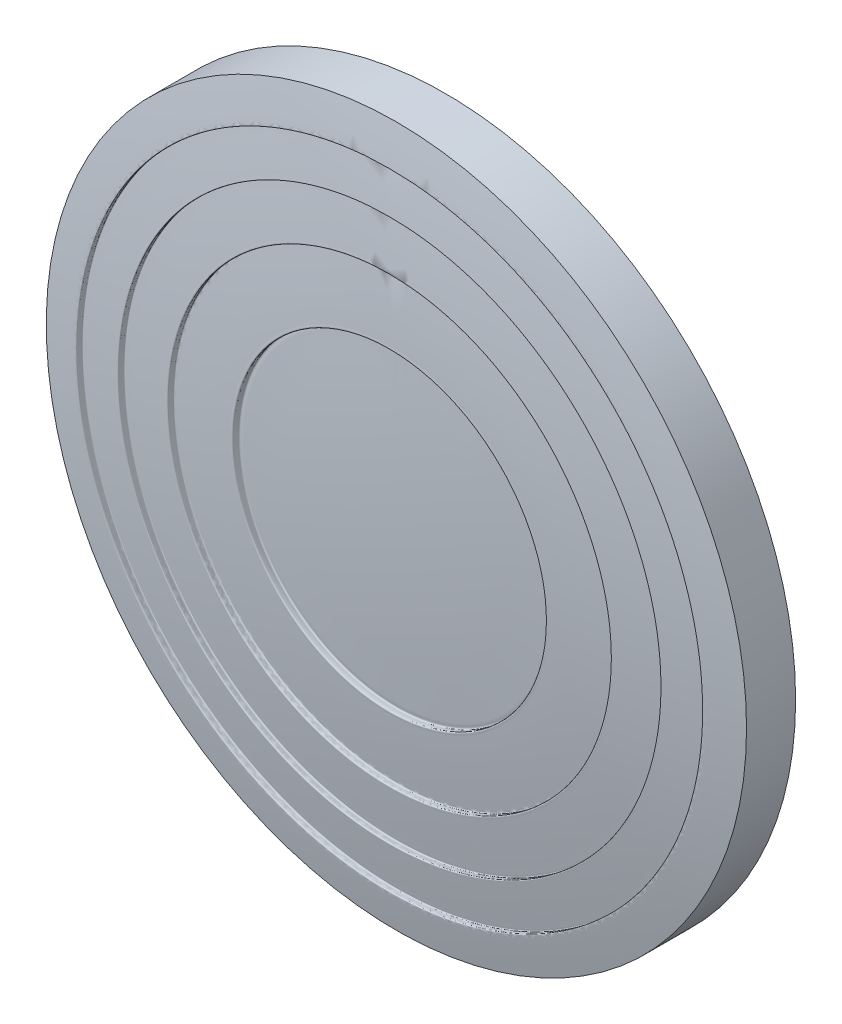
from build123d import *


with BuildPart() as part:
    # 草图3 → 旋转1 (revolve)
    with BuildSketch(Plane(origin=(0, 0, 0), x_dir=(0, 0, -1), z_dir=(1, 0, 0)), mode=Mode.PRIVATE) as revolve_1_sk:
        with BuildLine():
            Line((0, 5), (0.701015432, 5))
            Line((0.701015432, 5), (0.701015432, 0))
            Line((0.701015432, 0), (-0.10102051, 0))
            add(Edge.make_bspline(
                [(-0.10102051, 0), (-0.101012409, 0.015293919), (-0.100996206, 0.045881757), (-0.100646654, 0.168232704), (-0.098279915, 0.428222335), (-0.086950462, 0.90221887), (-0.064778455, 1.375856153), (-0.041552217, 1.726854364), (-0.03145601, 1.864129781), (-0.026803448, 1.925126023), (-0.02322188, 1.970874213), (-0.019586973, 2.016587805), (-0.015753867, 2.06239895), (-0.012263319, 2.107813726), (-0.007097278, 2.154674747), (-0.007787186, 2.196104551), (0.022411944, 2.282471532), (-0.111091677, 2.211001779), (-0.098584823, 2.26478721), (-0.097770103, 2.282897511), (-0.095779965, 2.302068529), (-0.094086497, 2.320953637), (-0.092295247, 2.339913652), (-0.088134179, 2.38410286), (-0.079573486, 2.472495628), (-0.061621889, 2.649154928), (-0.041403955, 2.831977619), (-0.024220105, 2.976832224), (-0.017323258, 3.033493776), (-0.014227077, 3.058675075), (-0.011897459, 3.07755322), (-0.009527768, 3.096452188), (-0.007239631, 3.115264994), (-0.004579127, 3.134390866), (-0.003240318, 3.152339812), (0.012205348, 3.206752658), (-0.111226787, 3.137613078), (-0.098662381, 3.186881965), (-0.097430662, 3.200817308), (-0.095384969, 3.215461155), (-0.09354664, 3.229913771), (-0.091642014, 3.244416227), (-0.085949136, 3.287879306), (-0.074326226, 3.374808841), (-0.052265321, 3.534037132), (-0.032503066, 3.669010118), (-0.017885129, 3.765338622), (-0.014200653, 3.789418002), (-0.011242215, 3.808673772), (-0.00899858, 3.823128276), (-0.006807559, 3.837529314), (-0.004380266, 3.852123697), (-0.002794738, 3.865990292), (0.011366689, 3.915234897), (-0.111356709, 3.846766066), (-0.098723242, 3.893389525), (-0.09728236, 3.905158859), (-0.095223418, 3.917451042), (-0.093322465, 3.929601924), (-0.090070959, 3.949914477), (-0.084224862, 3.986434808), (-0.07234561, 4.059488943), (-0.051457339, 4.185197592), (-0.031143797, 4.302684828), (-0.016760888, 4.383638431), (-0.013143752, 4.403874475), (-0.010970757, 4.416012298), (-0.008779541, 4.428159243), (-0.00662798, 4.440267045), (-0.00430008, 4.452515817), (-0.002602, 4.464233375), (0.011247197, 4.510754296), (-0.111611209, 4.442791892), (-0.098761621, 4.487656992), (-0.097199485, 4.498029103), (-0.095134939, 4.508816034), (-0.093199099, 4.51949073), (-0.089905403, 4.53733021), (-0.083325449, 4.572971249), (-0.069318967, 4.647825554), (-0.044163632, 4.779581517), (-0.020915695, 4.896956983), (-0.004344479, 4.978684175), (-0.001449381, 4.992894979), (0, 5)],
                knots=[0, 0, 0, 0, 0.008437201, 0.016874403, 0.067497613, 0.151869628, 0.278427653, 0.329050861, 0.345925263, 0.354362465, 0.362799668, 0.371236868, 0.379674071, 0.388111273, 0.396548473, 0.404985676, 0.413422876, 0.431999551, 0.435498382, 0.438997215, 0.442496046, 0.445994876, 0.449493708, 0.452992539, 0.470486696, 0.498477345, 0.550959815, 0.571952803, 0.578950466, 0.582449297, 0.585948128, 0.58944696, 0.59294579, 0.596444622, 0.599943454, 0.603442285, 0.62201896, 0.624706464, 0.627393967, 0.630081471, 0.632768976, 0.635456481, 0.638143983, 0.656956513, 0.683831555, 0.726831621, 0.73220663, 0.737581637, 0.740269143, 0.742956645, 0.745644151, 0.748331655, 0.751019158, 0.753706663, 0.772283338, 0.774551324, 0.776819309, 0.779087294, 0.78135528, 0.783623267, 0.790427225, 0.801767154, 0.824447013, 0.860734787, 0.867538745, 0.869806731, 0.872074718, 0.874342704, 0.87661069, 0.878878675, 0.881146661, 0.883414647, 0.901991322, 0.903991499, 0.905991676, 0.907991853, 0.909992029, 0.911992206, 0.917992738, 0.9299938, 0.953995926, 0.991999291, 0.995999647, 1, 1, 1, 1], degree=3))
        make_face()
    revolve(revolve_1_sk.sketch.rotate(Axis((0, 0, 0.290264711), (0, 0, -1)), 90), axis=Axis((0, 0, 0.290264711), (0, 0, -1)))


solid = part.part
